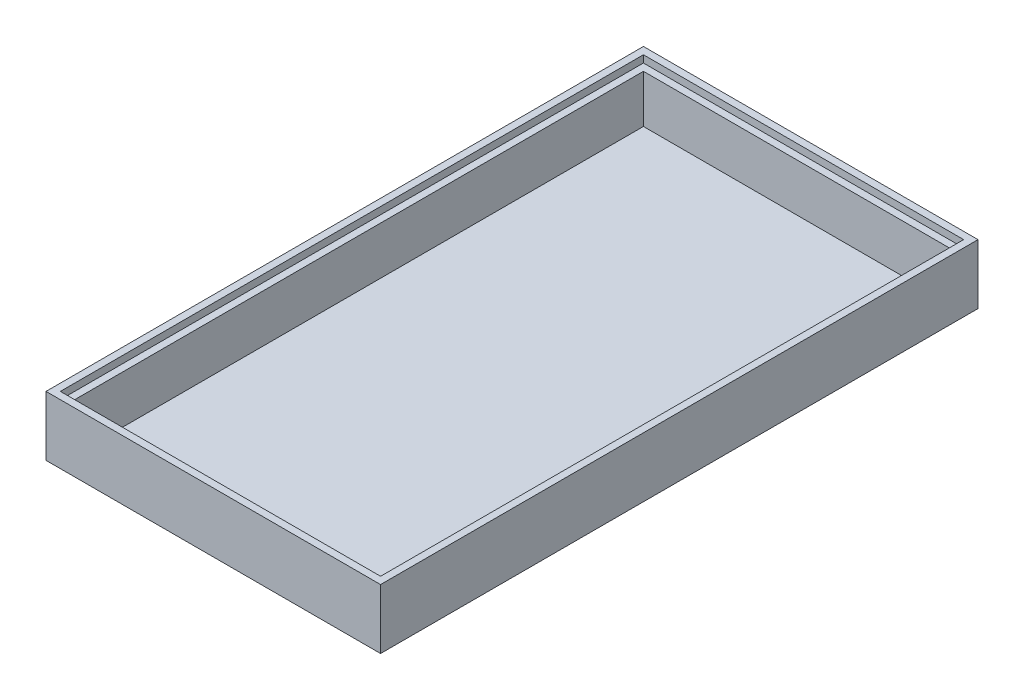
from build123d import *

# Parameters (mm, degrees)
SKETCH1_W           = 140
SKETCH1_H           = 250
BOSS_EXTRUDE1_DEPTH = 25
SKETCH2_W           = 128
SKETCH2_H           = 238
CUT_EXTRUDE1_DEPTH  = 23
SKETCH4_W           = 134
SKETCH4_H           = 244
CUT_EXTRUDE2_DEPTH  = 3


with BuildPart() as part:
    # Sketch1 → Boss-Extrude1 (new body)
    with BuildSketch(Plane(origin=(0, 0, 0), x_dir=(1, 0, 0), z_dir=(0, 1, 0))):
        Rectangle(SKETCH1_W, SKETCH1_H)
    extrude(amount=BOSS_EXTRUDE1_DEPTH)

    # Sketch2 → Cut-Extrude1 (cut)
    with BuildSketch(Plane(origin=(0, 25, 0), x_dir=(1, 0, 0), z_dir=(0, 1, 0))):
        Rectangle(SKETCH2_W, SKETCH2_H)
    extrude(amount=-CUT_EXTRUDE1_DEPTH, mode=Mode.SUBTRACT)

    # Sketch4 → Cut-Extrude2 (cut)
    with BuildSketch(Plane(origin=(0, 25, 0), x_dir=(1, 0, 0), z_dir=(0, 1, 0))):
        Rectangle(SKETCH4_W, SKETCH4_H)
    extrude(amount=-CUT_EXTRUDE2_DEPTH, mode=Mode.SUBTRACT)


solid = part.part
